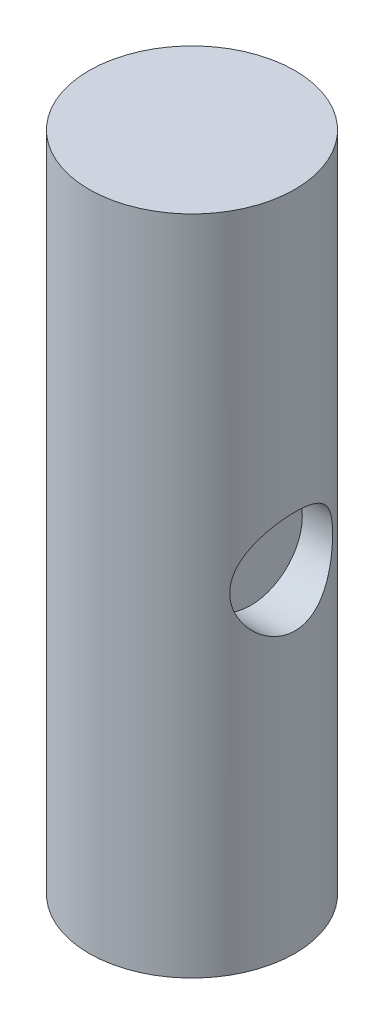
from build123d import *

# Parameters (mm, degrees)
SKETCH_1_R          = 7
EXTRUDE_1_DEPTH     = 45
CUT_EXTRUDE_1_DEPTH = 11
CUT_EXTRUDE_START   = 11
CUT_EXTRUDE_2_DEPTH = 11


with BuildPart() as part:
    # 草图1 → 凸台-拉伸1 (new body)
    with BuildSketch(Plane(origin=(0, 0, 0), x_dir=(1, 0, 0), z_dir=(0, 1, 0))):
        with Locations(Location((0, 0, 0), (0, 0, 90))):
            Circle(SKETCH_1_R)
    extrude(amount=EXTRUDE_1_DEPTH)

    # 草图4 → 切除-拉伸1 (cut)
    with BuildSketch(Plane(origin=(15, 0, 0), x_dir=(0, 0, -1), z_dir=(1, 0, 0))):
        with BuildLine():
            ThreePointArc((3.5, 22.5), (0, 26), (-3.5, 22.5))
            Line((-3.5, 22.5), (3.5, 22.5))
        make_face()
        with BuildLine():
            Line((3.5, 22.5), (-3.5, 22.5))
            ThreePointArc((-3.5, 22.5), (0, 19), (3.5, 22.5))
        make_face()
    extrude(amount=-CUT_EXTRUDE_1_DEPTH, mode=Mode.SUBTRACT)

    # 草图5 → 切除-拉伸2 (cut)
    with BuildSketch(Plane(origin=(-15, 0, 0), x_dir=(0, 0, -1), z_dir=(1, 0, 0)).offset(CUT_EXTRUDE_START)):
        with BuildLine():
            ThreePointArc((-3.5, 22.5), (0, 19), (3.5, 22.5))
            Line((3.5, 22.5), (-3.5, 22.5))
        make_face()
        with BuildLine():
            Line((-3.5, 22.5), (3.5, 22.5))
            ThreePointArc((3.5, 22.5), (0, 26), (-3.5, 22.5))
        make_face()
    extrude(amount=-CUT_EXTRUDE_2_DEPTH, mode=Mode.SUBTRACT)


solid = part.part
